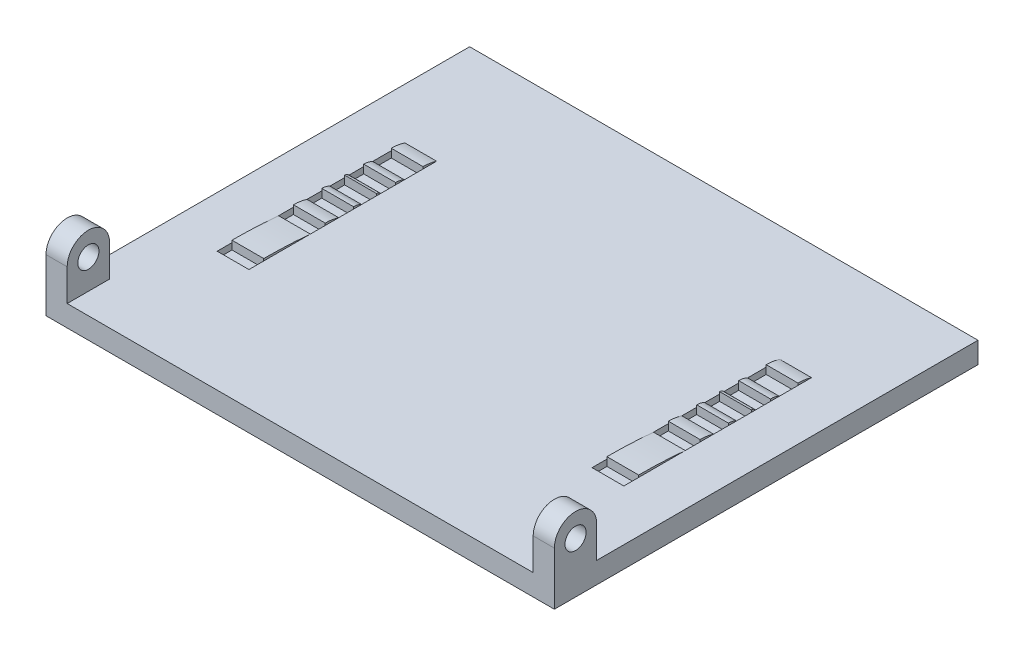
from build123d import *

# Parameters (mm, degrees)
SKETCH1_W           = 304.8
SKETCH1_H           = 254
BOSS_EXTRUDE1_DEPTH = 12.7
SKETCH2_W           = 12.7
SKETCH2_H           = 25.4
BOSS_EXTRUDE2_DEPTH = 19.05
BOSS_EXTRUDE3_DEPTH = 12.7
SKETCH5_R           = 6.35
CUT_EXTRUDE1_DEPTH  = 12.7
SKETCH6_W           = 19.05
SKETCH6_H           = 8.89
SKETCH6_H_2         = 11.176
CUT_EXTRUDE2_DEPTH  = 3.81
BOSS_EXTRUDE4_DEPTH = 19.05


with BuildPart() as part:
    # Sketch1 → Boss-Extrude1 (new body)
    with BuildSketch(Plane(origin=(0, 0, 0), x_dir=(1, 0, 0), z_dir=(0, 1, 0))):
        Rectangle(SKETCH1_W, SKETCH1_H)
    extrude(amount=BOSS_EXTRUDE1_DEPTH)

    # Sketch2 → Boss-Extrude2 (add)
    with BuildSketch(Plane(origin=(0, 12.7, 0), x_dir=(1, 0, 0), z_dir=(0, 1, 0))):
        with Locations((-146.05, -114.3)):
            Rectangle(SKETCH2_W, SKETCH2_H)
    boss_extrude2 = extrude(amount=BOSS_EXTRUDE2_DEPTH)

    # Sketch4 → Boss-Extrude3 (add)
    with BuildSketch(Plane(origin=(-139.7, 0, 0), x_dir=(0, 0, -1), z_dir=(1, 0, 0))):
        with BuildLine():
            Line((-127, 31.75), (-101.6, 31.75))
            ThreePointArc((-101.6, 31.75), (-114.3, 44.45), (-127, 31.75))
        make_face()
    boss_extrude3 = extrude(amount=-BOSS_EXTRUDE3_DEPTH)

    # Sketch5 → Cut-Extrude1 (cut)
    with BuildSketch(Plane(origin=(-139.7, 0, 0), x_dir=(0, 0, -1), z_dir=(1, 0, 0))):
        with Locations((-114.3, 30.48)):
            Circle(SKETCH5_R)
    cut_extrude1 = extrude(amount=-CUT_EXTRUDE1_DEPTH, mode=Mode.SUBTRACT)

    # Mirror1: Boss-Extrude2, Boss-Extrude3, Cut-Extrude1 across plane
    add(boss_extrude2.mirror(Plane(origin=(0, 0, 0), x_dir=(0, 0, 1), z_dir=(1, 0, 0))))
    add(boss_extrude3.mirror(Plane(origin=(0, 0, 0), x_dir=(0, 0, 1), z_dir=(1, 0, 0))))
    add(cut_extrude1.mirror(Plane(origin=(0, 0, 0), x_dir=(0, 0, 1), z_dir=(1, 0, 0))), mode=Mode.SUBTRACT)

    # Sketch6 → Cut-Extrude2 (cut)
    with BuildSketch(Plane(origin=(0, 12.7, 0), x_dir=(1, 0, 0), z_dir=(0, 1, 0))):
        with Locations((-112.395, -50.419)):
            Rectangle(SKETCH6_W, SKETCH6_H)
        with Locations((-112.395, -13.589)):
            Rectangle(SKETCH6_W, SKETCH6_H)
        with Locations((-112.395, 17.145)):
            Rectangle(SKETCH6_W, SKETCH6_H)
        with Locations((-112.395, 3.429)):
            Rectangle(SKETCH6_W, SKETCH6_H)
        with Locations((-112.395, 28.575)):
            Rectangle(SKETCH6_W, SKETCH6_H)
        with Locations((-112.395, 43.942)):
            Rectangle(SKETCH6_W, SKETCH6_H_2)
    cut_extrude2 = extrude(amount=-CUT_EXTRUDE2_DEPTH, mode=Mode.SUBTRACT)

    # Sketch7 → Boss-Extrude4 (add)
    with BuildSketch(Plane.ZY.offset(102.87)):
        with BuildLine():
            Line((45.974, 12.7), (45.974, 13.97))
            ThreePointArc((45.974, 13.97), (31.989575629, 13.652336171), (18.034, 12.7))
            Line((18.034, 12.7), (45.974, 12.7))
        make_face()
        with BuildLine():
            Line((9.144, 12.7), (9.144, 13.97))
            ThreePointArc((9.144, 13.97), (5.030689776, 13.650585434), (1.016, 12.7))
            Line((1.016, 12.7), (9.144, 12.7))
        make_face()
        with BuildLine():
            Line((-7.874, 12.7), (-12.7, 12.7))
            ThreePointArc((-12.7, 12.7), (-10.369154103, 13.647185593), (-7.874, 13.97))
            Line((-7.874, 13.97), (-7.874, 12.7))
        make_face()
        with BuildLine():
            Line((-21.59, 12.7), (-24.13, 12.7))
            ThreePointArc((-24.13, 12.7), (-23.009903166, 13.634806331), (-21.59, 13.97))
            Line((-21.59, 13.97), (-21.59, 12.7))
        make_face()
        with BuildLine():
            Line((-33.02, 12.7), (-38.354, 12.7))
            ThreePointArc((-38.354, 12.7), (-35.761553209, 13.64812348), (-33.02, 13.97))
            Line((-33.02, 13.97), (-33.02, 12.7))
        make_face()
        with BuildLine():
            Line((-49.53, 12.7), (-57.658, 12.7))
            ThreePointArc((-57.658, 12.7), (-53.643310224, 13.650585434), (-49.53, 13.97))
            Line((-49.53, 13.97), (-49.53, 12.7))
        make_face()
    boss_extrude4 = extrude(amount=BOSS_EXTRUDE4_DEPTH)

    # Mirror2: Cut-Extrude2, Boss-Extrude4 across plane
    add(cut_extrude2.mirror(Plane(origin=(0, 0, 0), x_dir=(0, 0, 1), z_dir=(1, 0, 0))), mode=Mode.SUBTRACT)
    add(boss_extrude4.mirror(Plane(origin=(0, 0, 0), x_dir=(0, 0, 1), z_dir=(1, 0, 0))))


solid = part.part
